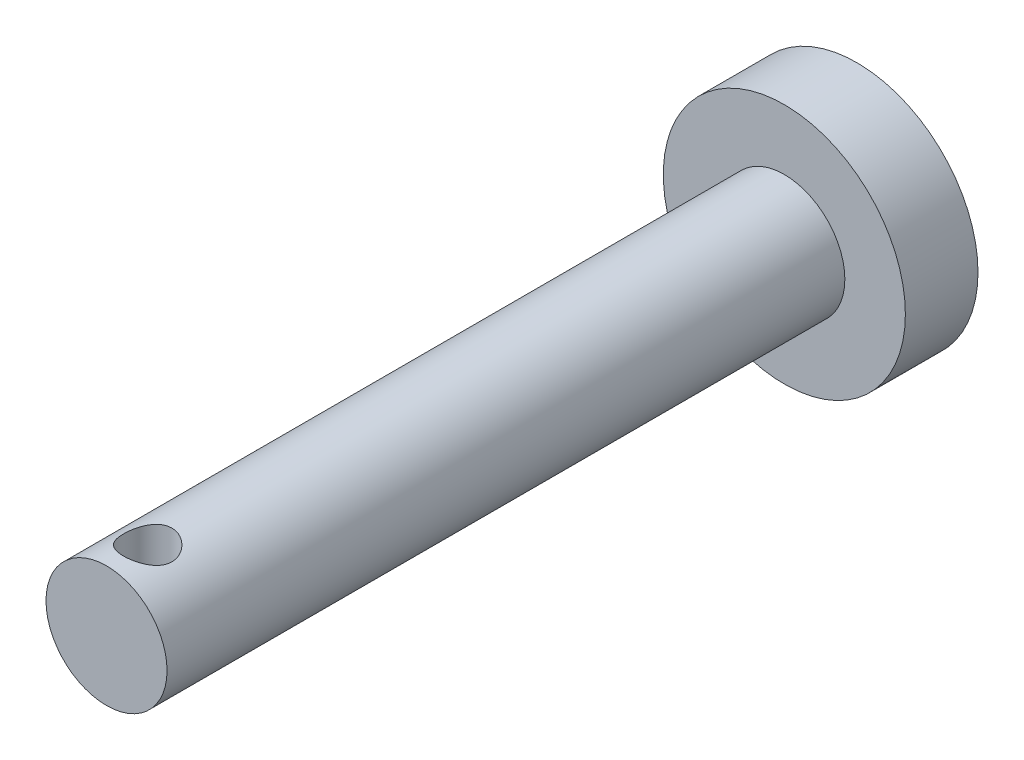
from build123d import *

# Parameters (mm, degrees)
CUT_EXTRUDE1_DEPTH      = 81.311892021
CUT_EXTRUDE1_DEPTH_BACK = 81.311892021
SKETCH3_W               = 130
SKETCH3_H               = 11.269282723
CUT_EXTRUDE2_DEPTH      = 81.311892021
CUT_EXTRUDE2_DEPTH_BACK = 81.311892021
SKETCH4_R               = 1


with BuildPart() as part:
    # Sketch2 → Revolve1 (revolve)
    with BuildSketch(Plane(origin=(0, 0, 0), x_dir=(0, 0, -1), z_dir=(1, 0, 0)), mode=Mode.PRIVATE) as revolve1_sk:
        Polygon((80, 0), (80, 5), (77, 5), (77, 2.5), (-80, 2.5), (-80, 0), align=None)
    revolve(revolve1_sk.sketch.rotate(Axis((0, 0, 80), (0, 0, -1)), 90), axis=Axis((0, 0, 80), (0, 0, -1)))

    # Sketch3 → Cut-Extrude1 (cut, two sides: drawn at the far end of the back side and taken through both)
    with BuildSketch(Plane(origin=(0, 0, 0), x_dir=(0, 0, -1), z_dir=(1, 0, 0)).offset(-CUT_EXTRUDE1_DEPTH_BACK)):
        with Locations((-16, 0.112241111)):
            Rectangle(SKETCH3_W, SKETCH3_H)
    extrude(amount=CUT_EXTRUDE1_DEPTH + CUT_EXTRUDE1_DEPTH_BACK, mode=Mode.SUBTRACT)

    # Sketch4 → Cut-Extrude2 (cut, two sides: drawn at the far end of the back side and taken through both)
    with BuildSketch(Plane(origin=(0, 0, 0), x_dir=(1, 0, 0), z_dir=(0, 1, 0)).offset(-CUT_EXTRUDE2_DEPTH_BACK)):
        with Locations(Location((0, 50.7, 0), (0, 0, 270))):
            Circle(SKETCH4_R)
    extrude(amount=CUT_EXTRUDE2_DEPTH + CUT_EXTRUDE2_DEPTH_BACK, mode=Mode.SUBTRACT)


solid = part.part
